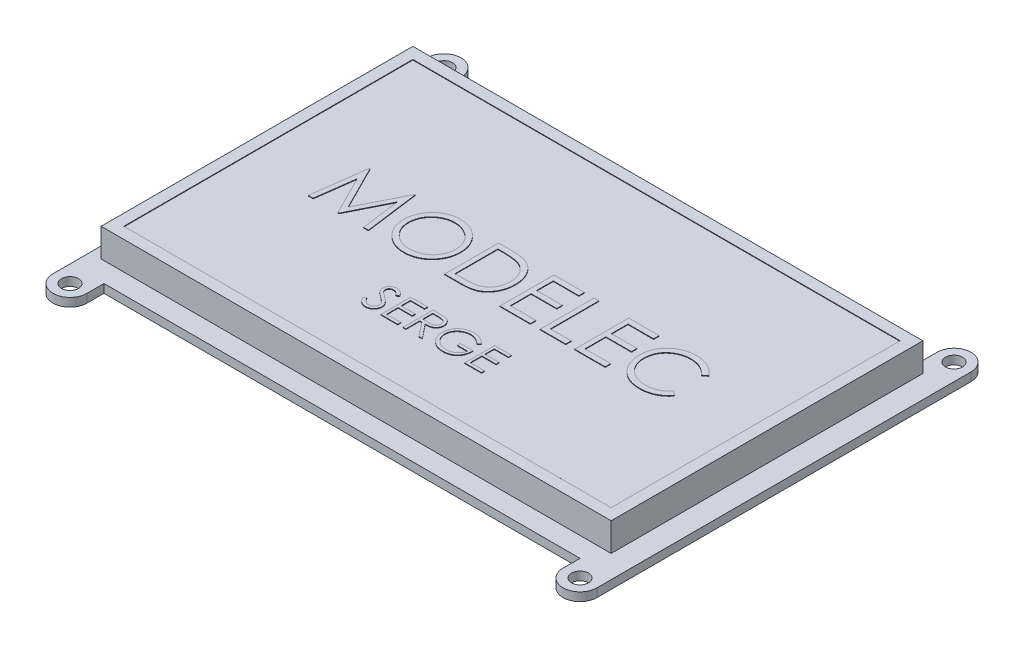
from build123d import *

# Parameters (mm, degrees)
ESQUISSE2_R             = 1.5
BOSS_EXTRU_1_DEPTH      = 1.5
ESQUISSE3_W             = 85
ESQUISSE3_H             = 50
BOSS_EXTRU_2_DEPTH      = 1
ESQUISSE4_W             = 90
ESQUISSE4_H             = 55
BOSS_EXTRU_3_DEPTH      = 5
ESQUISSE5_W             = 86
ESQUISSE5_H             = 51
ENL_V_MAT_EXTRU_1_DEPTH = 0.1
BOSS_EXTRU_4_DEPTH      = 0.1


with BuildPart() as part:
    # Esquisse2 → Boss.-Extru.1 (new body)
    with BuildSketch(Plane(origin=(0, 0, 0), x_dir=(1, 0, 0), z_dir=(0, 1, 0))):
        with BuildLine():
            ThreePointArc((-42, 33), (-45, 36), (-48, 33))
            Line((-48, 33), (-48, 30))
            Line((-48, 30), (-48, -30))
            Line((-48, -30), (-48, -33))
            ThreePointArc((-48, -33), (-45, -36), (-42, -33))
            Line((-42, -33), (-42, -30))
            Line((-42, -30), (42, -30))
            Line((42, -30), (42, -33))
            ThreePointArc((42, -33), (45, -36), (48, -33))
            Line((48, -33), (48, -30))
            Line((48, -30), (48, 30))
            Line((48, 30), (48, 33))
            ThreePointArc((48, 33), (45, 36), (42, 33))
            Line((42, 33), (42, 30))
            Line((42, 30), (-42, 30))
            Line((-42, 30), (-42, 33))
        make_face()
        with Locations(Location((-45, -33, 0), (0, 0, 270))):
            Circle(ESQUISSE2_R, mode=Mode.SUBTRACT)
        with Locations(Location((45, -33, 0), (0, 0, 270))):
            Circle(ESQUISSE2_R, mode=Mode.SUBTRACT)
        with Locations(Location((-45, 33, 0), (0, 0, 270))):
            Circle(ESQUISSE2_R, mode=Mode.SUBTRACT)
        with Locations(Location((45, 33, 0), (0, 0, 270))):
            Circle(ESQUISSE2_R, mode=Mode.SUBTRACT)
    extrude(amount=BOSS_EXTRU_1_DEPTH)


with BuildPart() as body_2:
    # Esquisse3 → Boss.-Extru.2 (new body)
    with BuildSketch(Plane(origin=(0, 1.5, 0), x_dir=(1, 0, 0), z_dir=(0, 1, 0))):
        Rectangle(ESQUISSE3_W, ESQUISSE3_H)
    extrude(amount=BOSS_EXTRU_2_DEPTH)

    # Esquisse4 → Boss.-Extru.3 (add)
    with BuildSketch(Plane(origin=(0, 2.5, 0), x_dir=(1, 0, 0), z_dir=(0, 1, 0))):
        Rectangle(ESQUISSE4_W, ESQUISSE4_H)
    extrude(amount=BOSS_EXTRU_3_DEPTH)

    # Esquisse5 → Enlèv. mat.-Extru.1 (cut)
    with BuildSketch(Plane(origin=(0, 7.5, 0), x_dir=(1, 0, 0), z_dir=(0, 1, 0))):
        Rectangle(ESQUISSE5_W, ESQUISSE5_H)
    extrude(amount=-ENL_V_MAT_EXTRU_1_DEPTH, mode=Mode.SUBTRACT)

    # Esquisse6 → Boss.-Extru.4 (add)
    # profile 1 of 12: a face of its own
    with BuildSketch(Plane(origin=(0, 7.4, 0), x_dir=(1, 0, 0), z_dir=(0, 1, 0))):
        Polygon((-31.444711538, -4.5), (-30.187304687, 5.025), (-30.065189303, 5.025), (-26.132692308, -2.790384615), (-22.209735577, 5.025), (-22.085712139, 5.025), (-20.820673077, -4.5), (-21.679296875, -4.5), (-22.591346154, 2.353725962), (-26.029657452, -4.5), (-26.222370793, -4.5), (-29.674038462, 2.368990385), (-30.584179687, -4.5), align=None)
    # profile 2 of 12: a face of its own
    with BuildSketch(Plane(origin=(0, 7.4, 0), x_dir=(1, 0, 0), z_dir=(0, 1, 0))):
        with BuildLine():
            add(Edge.make_bspline(
                [(-14.409615385, 5.269230769), (-14.233244754, 5.2647636), (-13.886838283, 5.255989712), (-13.377727311, 5.188827295), (-12.891693516, 5.072634841), (-12.424777638, 4.917886295), (-11.982564609, 4.711454004), (-11.561725909, 4.461939421), (-11.163262845, 4.166728487), (-10.792546085, 3.828103234), (-10.453301099, 3.459666835), (-10.154417795, 3.066480522), (-9.903931267, 2.650921639), (-9.698229946, 2.21423895), (-9.536853015, 1.757420037), (-9.425494761, 1.278029501), (-9.354361652, 0.779173437), (-9.346045572, 0.438921755), (-9.341826923, 0.266316106)],
                knots=[0, 0, 0, 0, 1.065120563, 2.091984664, 3.0946048, 4.079830382, 5.057816894, 6.036188127, 7.030412546, 8.04752943, 9.064399622, 10.05169764, 11.02544977, 11.989514704, 12.962713494, 13.945757189, 14.957906945, 16, 16, 16, 16], degree=3))
            add(Edge.make_bspline(
                [(-9.341826923, 0.266316106), (-9.346044954, 0.094981912), (-9.354359181, -0.242737632), (-9.42557564, -0.738428005), (-9.53726579, -1.214924829), (-9.696731343, -1.671432641), (-9.901452109, -2.108433011), (-10.153606539, -2.524776078), (-10.450626548, -2.920598335), (-10.788646621, -3.291563516), (-11.157130886, -3.631735204), (-11.552364683, -3.928150145), (-11.965459361, -4.183213655), (-12.401730781, -4.386732082), (-12.855393024, -4.549397094), (-13.330506346, -4.660302466), (-13.824844468, -4.731840777), (-14.161950557, -4.740055452), (-14.333293269, -4.744230769)],
                knots=[0, 0, 0, 0, 1.043624062, 2.057103931, 3.04512605, 4.022047818, 4.998200453, 5.980619268, 6.982898556, 8.009068085, 9.034988726, 10.034168286, 11.015286542, 11.987931943, 12.962482838, 13.94673481, 14.956375938, 16, 16, 16, 16], degree=3))
            add(Edge.make_bspline(
                [(-14.333293269, -4.744230769), (-14.505898023, -4.740014224), (-14.846147939, -4.73170229), (-15.345630871, -4.660451467), (-15.82535816, -4.549032633), (-16.28395793, -4.389803381), (-16.721685917, -4.184016489), (-17.139398213, -3.933088857), (-17.535418178, -3.635345138), (-17.906462503, -3.297434674), (-18.245958535, -2.92957495), (-18.541939407, -2.53541887), (-18.792923466, -2.122699378), (-18.998019392, -1.690271116), (-19.160391956, -1.240224546), (-19.271167212, -0.769557618), (-19.342838624, -0.280953678), (-19.351097742, 0.051721639), (-19.355288462, 0.220522837)],
                knots=[0, 0, 0, 0, 1.053102029, 2.075944431, 3.073151272, 4.055350789, 5.033113405, 6.020478099, 7.024410459, 8.052272461, 9.079885166, 10.07527673, 11.055994387, 12.023226415, 12.992069828, 13.970394897, 14.97016774, 16, 16, 16, 16], degree=3))
            add(Edge.make_bspline(
                [(-19.355288462, 0.220522837), (-19.353833489, 0.333823172), (-19.3509419, 0.558994508), (-19.316130222, 0.893367184), (-19.265615878, 1.222362474), (-19.193220673, 1.54504484), (-19.098537637, 1.860624377), (-18.986817477, 2.171277524), (-18.850365469, 2.473856087), (-18.696113134, 2.76979346), (-18.523950642, 3.054476403), (-18.333788781, 3.323570126), (-18.132306814, 3.579332696), (-17.911426436, 3.815136328), (-17.678427395, 4.037840778), (-17.429529952, 4.244023601), (-17.166252844, 4.435544003), (-16.887463225, 4.608137932), (-16.600030634, 4.764236719), (-16.30373026, 4.898190471), (-16.002586305, 5.01316011), (-15.695188299, 5.10634407), (-15.38235254, 5.179909825), (-15.063396255, 5.230004123), (-14.738573545, 5.264904588), (-14.519739884, 5.267782504), (-14.409615385, 5.269230769)],
                knots=[0, 0, 0, 0, 1.037015668, 2.060948919, 3.074880161, 4.083647147, 5.086022904, 6.090072063, 7.104153813, 8.122640571, 9.144368836, 10.147691507, 11.138137339, 12.123020368, 13.103399296, 14.087645067, 15.080126199, 16.082011238, 17.087798457, 18.072939717, 19.057185487, 20.037253025, 21.01195951, 21.997135196, 22.992090687, 24, 24, 24, 24], degree=3))
        make_face()
        with BuildLine():
            add(Edge.make_bspline(
                [(-14.367638221, 4.292307692), (-14.458029474, 4.291205812), (-14.637947833, 4.289012587), (-14.905422178, 4.260122675), (-15.169378798, 4.218947763), (-15.429872205, 4.160215196), (-15.685812464, 4.080194166), (-15.939585246, 3.988098552), (-16.188876414, 3.875918298), (-16.432862984, 3.74917401), (-16.669396153, 3.608887304), (-16.892587862, 3.453842709), (-17.103015914, 3.287676215), (-17.30016509, 3.110000029), (-17.483456494, 2.919909327), (-17.656497718, 2.720285912), (-17.812352793, 2.50542398), (-17.955188542, 2.281149944), (-18.083008164, 2.047755927), (-18.196669594, 1.807699087), (-18.289644504, 1.55902124), (-18.36546997, 1.304420282), (-18.428334456, 1.044299445), (-18.468159635, 0.776685457), (-18.497366984, 0.502923045), (-18.49943485, 0.317915285), (-18.500480769, 0.224338942)],
                knots=[0, 0, 0, 0, 1.008559885, 2.007477868, 2.99961109, 3.989939068, 4.984837346, 5.991145699, 7.001802488, 8.033829008, 9.059044045, 10.069351652, 11.065060232, 12.050310815, 13.029377138, 14.011219647, 14.996725999, 15.989392538, 16.977580475, 17.965360261, 18.951710183, 19.937753436, 20.929683414, 21.935841486, 22.955955122, 24, 24, 24, 24], degree=3))
            add(Edge.make_bspline(
                [(-18.500480769, 0.224338942), (-18.497011323, 0.08673747), (-18.49018585, -0.183967195), (-18.430429892, -0.580664786), (-18.338385804, -0.961905051), (-18.202702543, -1.325601961), (-18.033019798, -1.67488176), (-17.823396618, -2.006645959), (-17.575041536, -2.320984224), (-17.292928652, -2.615702063), (-16.984529001, -2.884703859), (-16.657052072, -3.120824278), (-16.314006183, -3.32060503), (-15.954496752, -3.483360262), (-15.580443093, -3.612328049), (-15.1894349, -3.700716323), (-14.784076864, -3.758888098), (-14.507768438, -3.764474527), (-14.367638221, -3.767307692)],
                knots=[0, 0, 0, 0, 1.032063989, 2.030389145, 3.003944642, 3.970395727, 4.937377036, 5.913328081, 6.909231446, 7.93887556, 8.970685674, 9.976071282, 10.964166581, 11.944589148, 12.933237628, 13.927779006, 14.949070134, 16, 16, 16, 16], degree=3))
            add(Edge.make_bspline(
                [(-14.367638221, -3.767307692), (-14.273450935, -3.766013641), (-14.086649257, -3.763447149), (-13.808803586, -3.737597178), (-13.535963466, -3.696144734), (-13.26851159, -3.636462021), (-13.006751497, -3.561766409), (-12.74959064, -3.473026807), (-12.49976815, -3.362315817), (-12.254132448, -3.239993177), (-12.019011247, -3.100546748), (-11.794559977, -2.950764355), (-11.586436061, -2.784842609), (-11.389434374, -2.609806276), (-11.205390449, -2.42212609), (-11.035548856, -2.222046058), (-10.880481496, -2.008303269), (-10.737699986, -1.784369415), (-10.61032825, -1.550336756), (-10.499350845, -1.309409561), (-10.405199987, -1.062181085), (-10.329194556, -0.808294737), (-10.269634835, -0.548232713), (-10.22859591, -0.2816468), (-10.199889088, -0.009070304), (-10.197725342, 0.175289762), (-10.196634615, 0.268224159)],
                knots=[0, 0, 0, 0, 1.047197238, 2.076906641, 3.100256066, 4.114471768, 5.12198147, 6.126382909, 7.136867548, 8.15857795, 9.17633901, 10.174870724, 11.156907918, 12.133735059, 13.104061851, 14.077631395, 15.04955518, 16.038496417, 17.029181396, 18.010275684, 18.986308667, 19.968651475, 20.955262928, 21.950658345, 22.966943676, 24, 24, 24, 24], degree=3))
            add(Edge.make_bspline(
                [(-10.196634615, 0.268224159), (-10.197726216, 0.360522781), (-10.199891606, 0.5436141), (-10.228582198, 0.814289613), (-10.269678192, 1.078957282), (-10.328903848, 1.33657806), (-10.405240337, 1.587217617), (-10.499367287, 1.830640552), (-10.610361566, 2.067753712), (-10.737746805, 2.297971048), (-10.88093701, 2.5188823), (-11.037403487, 2.730071722), (-11.209847756, 2.927573254), (-11.393342866, 3.116262671), (-11.592472204, 3.292115642), (-11.806333747, 3.455190502), (-12.032331185, 3.60942277), (-12.271618875, 3.748557335), (-12.518572064, 3.877047497), (-12.771975049, 3.987132012), (-13.028957099, 4.08067328), (-13.288864719, 4.160457306), (-13.553885539, 4.218717731), (-13.822228816, 4.260159781), (-14.093523291, 4.289002531), (-14.275976625, 4.291202476), (-14.367638221, 4.292307692)],
                knots=[0, 0, 0, 0, 1.02996197, 2.043119294, 3.035359645, 4.018872909, 4.991431989, 5.957985074, 6.929999688, 7.912076566, 8.892894881, 9.867085534, 10.843653904, 11.817741046, 12.803660682, 13.806313499, 14.818574707, 15.856120519, 16.894564902, 17.924820532, 18.937903209, 19.946497019, 20.957711757, 21.963978472, 22.977135795, 24, 24, 24, 24], degree=3))
        make_face(mode=Mode.SUBTRACT)
    # profile 3 of 12: a face of its own
    with BuildSketch(Plane(origin=(0, 7.4, 0), x_dir=(1, 0, 0), z_dir=(0, 1, 0))):
        with BuildLine():
            Line((-7.387980769, -4.5), (-7.387980769, 5.025))
            Line((-7.387980769, 5.025), (-5.464663462, 5.025))
            add(Edge.make_bspline(
                [(-5.464663462, 5.025), (-5.297380001, 5.023795577), (-4.974189225, 5.021468639), (-4.507158207, 5.00671471), (-4.07503954, 4.980614943), (-3.679254402, 4.942597875), (-3.318716246, 4.895917119), (-2.994434606, 4.837405305), (-2.704732702, 4.768313212), (-2.526562296, 4.709406666), (-2.442307692, 4.681550481)],
                knots=[0, 0, 0, 0, 1.314313732, 2.53924729, 3.670748893, 4.714932338, 5.66265055, 6.526160246, 7.303039223, 8, 8, 8, 8], degree=3))
            add(Edge.make_bspline(
                [(-2.442307692, 4.681550481), (-2.332104152, 4.639556918), (-2.114196121, 4.556522066), (-1.803933881, 4.399886703), (-1.511855571, 4.222413905), (-1.236394899, 4.023869735), (-0.983844078, 3.798632473), (-0.744336873, 3.556269975), (-0.527671089, 3.28796885), (-0.329256369, 2.999293347), (-0.150361468, 2.693644119), (0.005138669, 2.371603573), (0.134281322, 2.034807171), (0.241487175, 1.684191518), (0.325977891, 1.318985661), (0.383623005, 0.938764355), (0.421644056, 0.545030275), (0.425465082, 0.277855484), (0.427403846, 0.142292668)],
                knots=[0, 0, 0, 0, 0.984719456, 1.947108742, 2.898477687, 3.838006223, 4.779231079, 5.722358779, 6.681677486, 7.655904652, 8.64651281, 9.637519902, 10.640069247, 11.656948941, 12.698408672, 13.768548281, 14.867775369, 16, 16, 16, 16], degree=3))
            add(Edge.make_bspline(
                [(0.427403846, 0.142292668), (0.425692156, 0.024560298), (0.422319092, -0.207443635), (0.392031454, -0.549366358), (0.348008754, -0.881145434), (0.279852759, -1.201200947), (0.19711449, -1.512337025), (0.091076335, -1.811237633), (-0.030395979, -2.100644714), (-0.172046006, -2.376645131), (-0.327552204, -2.638129165), (-0.494434948, -2.884623996), (-0.67251624, -3.112612278), (-0.863494212, -3.322784429), (-1.064900926, -3.51482361), (-1.278054998, -3.690334024), (-1.503506443, -3.845881505), (-1.740245481, -3.987578421), (-1.995178376, -4.111186674), (-2.27313384, -4.215771201), (-2.57529726, -4.30243949), (-2.900926957, -4.374750285), (-3.250585565, -4.432110658), (-3.624615893, -4.470554626), (-4.022443274, -4.49655225), (-4.295618275, -4.498828435), (-4.436222957, -4.5)],
                knots=[0, 0, 0, 0, 1.105936401, 2.179363191, 3.223086493, 4.248585256, 5.251745608, 6.245858792, 7.225916811, 8.198733463, 9.158002045, 10.082870192, 10.993790845, 11.873723703, 12.748670949, 13.606408763, 14.465103618, 15.319838547, 16.196477973, 17.123216899, 18.106603292, 19.147568657, 20.255746949, 21.433717677, 22.679120308, 24, 24, 24, 24], degree=3))
            Line((-4.436222957, -4.5), (-7.387980769, -4.5))
        make_face()
        with BuildLine():
            Line((-6.533173077, -3.523076923), (-5.439858774, -3.523076923))
            add(Edge.make_bspline(
                [(-5.439858774, -3.523076923), (-5.282755137, -3.522401747), (-4.980587307, -3.521103135), (-4.546089471, -3.50970796), (-4.149089114, -3.491088116), (-3.789529863, -3.465030226), (-3.467614733, -3.430553495), (-3.182670956, -3.392113581), (-2.935632575, -3.344223375), (-2.786146035, -3.300813979), (-2.717067308, -3.280754207)],
                knots=[0, 0, 0, 0, 1.375205317, 2.645023457, 3.804390687, 4.853969522, 5.800190428, 6.637939096, 7.370582563, 8, 8, 8, 8], degree=3))
            add(Edge.make_bspline(
                [(-2.717067308, -3.280754207), (-2.630122122, -3.250133895), (-2.458308436, -3.189624636), (-2.210982054, -3.079249858), (-1.98032192, -2.948506797), (-1.762308208, -2.803176323), (-1.560033524, -2.63813256), (-1.371100751, -2.456964369), (-1.195890277, -2.258749731), (-1.036212339, -2.043734663), (-0.89331474, -1.813257433), (-0.769568037, -1.569583893), (-0.66111494, -1.315383931), (-0.575992485, -1.046754006), (-0.509275073, -0.76609564), (-0.462018315, -0.473389089), (-0.432586815, -0.168689014), (-0.429153875, 0.038553552), (-0.427403846, 0.144200721)],
                knots=[0, 0, 0, 0, 0.998632004, 1.973411704, 2.929992603, 3.868527914, 4.809262121, 5.754881198, 6.702106254, 7.672490631, 8.653608572, 9.636854334, 10.631411391, 11.644891563, 12.686317036, 13.754757253, 14.855430412, 16, 16, 16, 16], degree=3))
            add(Edge.make_bspline(
                [(-0.427403846, 0.144200721), (-0.428800721, 0.255598264), (-0.431544894, 0.474439723), (-0.466037125, 0.795542972), (-0.516442215, 1.104372457), (-0.589332103, 1.400948831), (-0.682216852, 1.685850704), (-0.798135127, 1.957502371), (-0.930577855, 2.218772764), (-1.088157651, 2.463631574), (-1.260738658, 2.695206392), (-1.45226703, 2.907355127), (-1.659699863, 3.100561044), (-1.880774704, 3.277833031), (-2.121722095, 3.432039177), (-2.376866068, 3.569979359), (-2.649949645, 3.687044035), (-2.83993991, 3.749307226), (-2.936493389, 3.780949519)],
                knots=[0, 0, 0, 0, 1.122418816, 2.205001699, 3.251619955, 4.274784885, 5.280384055, 6.268708349, 7.249350384, 8.229342522, 9.199999885, 10.157847722, 11.105861043, 12.055065948, 13.010012805, 13.98527497, 14.976112212, 16, 16, 16, 16], degree=3))
            add(Edge.make_bspline(
                [(-2.936493389, 3.780949519), (-3.016370438, 3.803037798), (-3.186210958, 3.850003539), (-3.463359786, 3.901235445), (-3.775276728, 3.946423404), (-4.123346629, 3.984681353), (-4.507172721, 4.012133278), (-4.927050201, 4.03273807), (-5.383160553, 4.046635405), (-5.69934302, 4.047584387), (-5.863446514, 4.048076923)],
                knots=[0, 0, 0, 0, 0.674548936, 1.434276114, 2.292660221, 3.240891867, 4.284742987, 5.42552168, 6.663806718, 8, 8, 8, 8], degree=3))
            Line((-5.863446514, 4.048076923), (-6.533173077, 4.048076923))
            Line((-6.533173077, 4.048076923), (-6.533173077, -3.523076923))
        make_face(mode=Mode.SUBTRACT)
    # profile 4 of 12: a face of its own
    with BuildSketch(Plane(origin=(0, 7.4, 0), x_dir=(1, 0, 0), z_dir=(0, 1, 0))):
        Polygon((2.38125, 5.025), (7.754326923, 5.025), (7.754326923, 4.048076923), (3.236057692, 4.048076923), (3.236057692, 1.117307692), (7.754326923, 1.117307692), (7.754326923, 0.140384615), (3.236057692, 0.140384615), (3.236057692, -3.523076923), (7.754326923, -3.523076923), (7.754326923, -4.5), (2.38125, -4.5), align=None)
    # profile 5 of 12: a face of its own
    with BuildSketch(Plane(origin=(0, 7.4, 0), x_dir=(1, 0, 0), z_dir=(0, 1, 0))):
        Polygon((9.463942308, 5.025), (10.31875, 5.025), (10.31875, -3.523076923), (13.982211538, -3.523076923), (13.982211538, -4.5), (9.463942308, -4.5), align=None)
    # profile 6 of 12: a face of its own
    with BuildSketch(Plane(origin=(0, 7.4, 0), x_dir=(1, 0, 0), z_dir=(0, 1, 0))):
        Polygon((15.569711538, 5.025), (20.942788462, 5.025), (20.942788462, 4.048076923), (16.424519231, 4.048076923), (16.424519231, 1.117307692), (20.942788462, 1.117307692), (20.942788462, 0.140384615), (16.424519231, 0.140384615), (16.424519231, -3.523076923), (20.942788462, -3.523076923), (20.942788462, -4.5), (15.569711538, -4.5), align=None)
    # profile 7 of 12: a face of its own
    with BuildSketch(Plane(origin=(0, 7.4, 0), x_dir=(1, 0, 0), z_dir=(0, 1, 0))):
        with BuildLine():
            Line((31.444711538, 3.277223558), (30.696754808, 2.704807692))
            add(Edge.make_bspline(
                [(30.696754808, 2.704807692), (30.643398783, 2.76839651), (30.537406088, 2.894716831), (30.366883544, 3.072098305), (30.189169788, 3.238283053), (30.004332751, 3.394062739), (29.809045433, 3.533989795), (29.608038545, 3.665356153), (29.397949579, 3.783106212), (29.107432358, 3.925880481), (28.727390714, 4.074868231), (28.248977616, 4.199790597), (27.74956527, 4.279313939), (27.408848945, 4.287926829), (27.235546875, 4.292307692)],
                knots=[0, 0, 0, 0, 0.757959112, 1.505699292, 2.245454638, 2.979532153, 3.711538275, 4.438200793, 5.171680507, 5.909471876, 7.393775596, 8.890124382, 10.418191784, 12, 12, 12, 12], degree=3))
            add(Edge.make_bspline(
                [(27.235546875, 4.292307692), (27.140070182, 4.291208337), (26.950002909, 4.28901983), (26.667930992, 4.260147854), (26.391126189, 4.219568061), (26.119768555, 4.159355574), (25.854203504, 4.083230089), (25.592694896, 3.992265213), (25.339028906, 3.87972097), (25.089696415, 3.755329205), (24.850811562, 3.614828802), (24.624783182, 3.461576037), (24.412435641, 3.297285853), (24.213600961, 3.121342485), (24.028075873, 2.934538293), (23.857204691, 2.734882477), (23.701578682, 2.523013348), (23.558113064, 2.301724718), (23.429626982, 2.071661156), (23.322049239, 1.831971143), (23.226785299, 1.586759263), (23.151403789, 1.333255032), (23.091737782, 1.073242219), (23.050568927, 0.806023003), (23.022025302, 0.532155633), (23.019847678, 0.34652886), (23.01875, 0.252959736)],
                knots=[0, 0, 0, 0, 1.054917814, 2.100044995, 3.131103042, 4.146048494, 5.169673617, 6.183595914, 7.203665975, 8.234915748, 9.262203917, 10.264457458, 11.251630812, 12.227803204, 13.197192746, 14.159520551, 15.12972552, 16.100847026, 17.073214652, 18.039054194, 19.002613845, 19.979014051, 20.95965708, 21.949030935, 22.966165397, 24, 24, 24, 24], degree=3))
            add(Edge.make_bspline(
                [(23.01875, 0.252959736), (23.02218395, 0.112176644), (23.028926056, -0.164232284), (23.088929023, -0.569100874), (23.180110735, -0.956960708), (23.316768841, -1.325387278), (23.485277115, -1.678923596), (23.69820335, -2.011587904), (23.944809784, -2.328407269), (24.228585168, -2.621894148), (24.539932425, -2.889992215), (24.873982098, -3.126077726), (25.229902196, -3.322877513), (25.603762882, -3.486642053), (25.998441092, -3.612526434), (26.41322709, -3.70114737), (26.847218735, -3.758956447), (27.143771173, -3.764490984), (27.294696514, -3.767307692)],
                knots=[0, 0, 0, 0, 1.029171465, 2.020641659, 2.987623507, 3.938342917, 4.889210282, 5.84687017, 6.821220943, 7.821438502, 8.827599549, 9.822697543, 10.807740252, 11.797342354, 12.80366471, 13.83203677, 14.896651826, 16, 16, 16, 16], degree=3))
            add(Edge.make_bspline(
                [(27.294696514, -3.767307692), (27.460983118, -3.762711799), (27.788274933, -3.753665981), (28.268247919, -3.677032596), (28.727722395, -3.552777834), (29.166723077, -3.378884202), (29.584012365, -3.152827955), (29.980243276, -2.878785874), (30.355750264, -2.554151197), (30.581550682, -2.306274969), (30.696754808, -2.179807692)],
                knots=[0, 0, 0, 0, 1.028121516, 2.023589091, 2.998037872, 3.967518031, 4.937445131, 5.927275754, 6.942489185, 8, 8, 8, 8], degree=3))
            Line((30.696754808, -2.179807692), (31.444711538, -2.746499399))
            add(Edge.make_bspline(
                [(31.444711538, -2.746499399), (31.384518682, -2.824164757), (31.26442129, -2.979123462), (31.069953401, -3.197577186), (30.865091613, -3.403056025), (30.648314288, -3.593903338), (30.422115155, -3.77393799), (30.182432648, -3.938045117), (29.932417638, -4.088515309), (29.672917235, -4.226292868), (29.404207153, -4.348531947), (29.126609369, -4.45318113), (28.841320446, -4.543328151), (28.548327341, -4.61749235), (28.247022317, -4.675380085), (27.93849267, -4.714077915), (27.622072509, -4.740589839), (27.408599785, -4.743006238), (27.300420673, -4.744230769)],
                knots=[0, 0, 0, 0, 0.986787822, 1.968848986, 2.935600012, 3.899624008, 4.868462664, 5.837806735, 6.815139263, 7.798259679, 8.787526145, 9.778297419, 10.776456485, 11.791383307, 12.812564526, 13.85620153, 14.913611965, 16, 16, 16, 16], degree=3))
            add(Edge.make_bspline(
                [(27.300420673, -4.744230769), (27.197976122, -4.743517775), (26.995404708, -4.742107918), (26.696323106, -4.719269234), (26.405158604, -4.688109592), (26.122743372, -4.641191807), (25.847536254, -4.585826139), (25.582032092, -4.511609362), (25.323618269, -4.428471987), (25.073332999, -4.33075913), (24.830963388, -4.220497234), (24.597291158, -4.095878777), (24.372423782, -3.957951702), (24.154150458, -3.809756281), (23.945695605, -3.646532338), (23.745252797, -3.470546711), (23.551698058, -3.282392554), (23.431947894, -3.146716131), (23.371739784, -3.078500601)],
                knots=[0, 0, 0, 0, 1.114604814, 2.203992996, 3.262667896, 4.300477797, 5.318619304, 6.316056647, 7.298880507, 8.271930387, 9.238335007, 10.195173496, 11.151986948, 12.108099108, 13.064862484, 14.031167946, 15.010108607, 16, 16, 16, 16], degree=3))
            add(Edge.make_bspline(
                [(23.371739784, -3.078500601), (23.275304211, -2.960006365), (23.08359732, -2.724448461), (22.83832671, -2.342670183), (22.628375149, -1.944067415), (22.458623536, -1.526546037), (22.325919241, -1.091042933), (22.233986132, -0.637338569), (22.174246408, -0.165856669), (22.167414836, 0.154827734), (22.163942308, 0.317833534)],
                knots=[0, 0, 0, 0, 0.994628077, 1.977248131, 2.950237994, 3.925870899, 4.908910175, 5.911660606, 6.938484602, 8, 8, 8, 8], degree=3))
            add(Edge.make_bspline(
                [(22.163942308, 0.317833534), (22.168174656, 0.489162304), (22.176501537, 0.826240963), (22.247247237, 1.320925793), (22.361054104, 1.794866385), (22.522698494, 2.247178004), (22.727636628, 2.680239696), (22.980801913, 3.09074326), (23.279253207, 3.481313979), (23.620649802, 3.846025553), (23.995029479, 4.179507648), (24.395947108, 4.472894531), (24.822617978, 4.717054342), (25.27034156, 4.921151041), (25.742470451, 5.07802633), (26.237997334, 5.187844646), (26.755991095, 5.256199084), (27.10940241, 5.264840185), (27.288972356, 5.269230769)],
                knots=[0, 0, 0, 0, 1.032925535, 2.032216505, 3.007276963, 3.968222605, 4.92396291, 5.891752235, 6.871517503, 7.883894988, 8.900124299, 9.891468569, 10.874487609, 11.85992873, 12.854644235, 13.869047385, 14.917252991, 16, 16, 16, 16], degree=3))
            add(Edge.make_bspline(
                [(27.288972356, 5.269230769), (27.398413169, 5.267918665), (27.615040236, 5.265321486), (27.935495669, 5.239995485), (28.247486573, 5.197776313), (28.551227888, 5.140310438), (28.848197294, 5.068989084), (29.136125092, 4.976078701), (29.416700804, 4.869843569), (29.68815489, 4.747492316), (29.94918493, 4.610150684), (30.199709626, 4.459341022), (30.437738991, 4.295250294), (30.664947929, 4.119274081), (30.877535617, 3.927689431), (31.081537927, 3.725765973), (31.270027004, 3.507687495), (31.38637677, 3.354185496), (31.444711538, 3.277223558)],
                knots=[0, 0, 0, 0, 1.096760587, 2.17092713, 3.219439832, 4.250915756, 5.268269357, 6.278326846, 7.281116186, 8.274029601, 9.260640565, 10.235837813, 11.203064059, 12.156899882, 13.114053108, 14.069676657, 15.032185724, 16, 16, 16, 16], degree=3))
        make_face()
    # profile 8 of 12: a face of its own
    with BuildSketch(Plane(origin=(0, 7.4, 0), x_dir=(1, 0, 0), z_dir=(0, 1, 0))):
        with BuildLine():
            Line((-11.058226496, -15.277400484), (-10.610894097, -15.009213051))
            add(Edge.make_bspline(
                [(-10.610894097, -15.009213051), (-10.569289143, -15.078858014), (-10.489575657, -15.212295075), (-10.356601578, -15.392601874), (-10.218817296, -15.545851802), (-10.07520247, -15.671153339), (-9.926633715, -15.769803442), (-9.772141158, -15.839656816), (-9.61224542, -15.883223826), (-9.503427857, -15.888515624), (-9.449101896, -15.891157495)],
                knots=[0, 0, 0, 0, 1.272034388, 2.437168799, 3.508375237, 4.49857839, 5.41946034, 6.295179144, 7.148887113, 8, 8, 8, 8], degree=3))
            add(Edge.make_bspline(
                [(-9.449101896, -15.891157495), (-9.402706286, -15.889865312), (-9.310726879, -15.887303555), (-9.175317297, -15.862688533), (-9.043809096, -15.824872576), (-8.918912704, -15.770714739), (-8.802351477, -15.705191076), (-8.700136592, -15.626048641), (-8.611771635, -15.53744164), (-8.539488807, -15.438589293), (-8.484032087, -15.332276461), (-8.441408365, -15.223153296), (-8.417754504, -15.10950558), (-8.414191317, -15.03298738), (-8.412393162, -14.994372639)],
                knots=[0, 0, 0, 0, 1.095163259, 2.171163733, 3.241058638, 4.321873601, 5.38011039, 6.391990106, 7.366004449, 8.327778327, 9.272591725, 10.192022065, 11.087607919, 12, 12, 12, 12], degree=3))
            add(Edge.make_bspline(
                [(-8.412393162, -14.994372639), (-8.41462218, -14.95031445), (-8.419153446, -14.860750589), (-8.457452232, -14.728610638), (-8.517700498, -14.597842109), (-8.573282114, -14.516953291), (-8.602138421, -14.474958243)],
                knots=[0, 0, 0, 0, 0.938893495, 1.908633276, 2.914225137, 4, 4, 4, 4], degree=3))
            add(Edge.make_bspline(
                [(-8.602138421, -14.474958243), (-8.625830898, -14.444649355), (-8.675570288, -14.381019636), (-8.76107986, -14.286306006), (-8.861419105, -14.188609111), (-8.973154241, -14.084198394), (-9.100355459, -13.977929939), (-9.239038725, -13.864736233), (-9.392744797, -13.748921944), (-9.500542846, -13.671251517), (-9.556164864, -13.631174856)],
                knots=[0, 0, 0, 0, 0.722233717, 1.516239348, 2.393582979, 3.351407094, 4.387010283, 5.505090956, 6.712668013, 8, 8, 8, 8], degree=3))
            add(Edge.make_bspline(
                [(-9.556164864, -13.631174856), (-9.611839239, -13.59151973), (-9.718284405, -13.515702148), (-9.867144404, -13.403179718), (-10.000259247, -13.300303868), (-10.117037284, -13.206106135), (-10.217427151, -13.120573745), (-10.302219927, -13.044528051), (-10.369255602, -12.975912429), (-10.406532492, -12.931399924), (-10.423268897, -12.911414907)],
                knots=[0, 0, 0, 0, 1.452282411, 2.77665338, 3.964542531, 5.026858415, 5.96415736, 6.766646006, 7.446254459, 8, 8, 8, 8], degree=3))
            add(Edge.make_bspline(
                [(-10.423268897, -12.911414907), (-10.446661912, -12.880268101), (-10.492667415, -12.819013728), (-10.55339459, -12.723272574), (-10.605009753, -12.62526597), (-10.64547185, -12.524730556), (-10.679544467, -12.423077747), (-10.702461814, -12.31898122), (-10.716811902, -12.212908071), (-10.718281453, -12.141525755), (-10.719017094, -12.105792578)],
                knots=[0, 0, 0, 0, 1.068054152, 2.10047183, 3.106115577, 4.101338837, 5.06977816, 6.043150881, 7.020423561, 8, 8, 8, 8], degree=3))
            add(Edge.make_bspline(
                [(-10.719017094, -12.105792578), (-10.717043742, -12.049807086), (-10.713139218, -11.939032751), (-10.680118436, -11.777212329), (-10.627998704, -11.622716198), (-10.554981433, -11.477073908), (-10.460854245, -11.344077722), (-10.351927593, -11.222197808), (-10.222188798, -11.119738165), (-10.079838999, -11.030215172), (-9.924027579, -10.960144547), (-9.760755618, -10.907286875), (-9.589763616, -10.877337164), (-9.473946972, -10.873039174), (-9.415180956, -10.87085835)],
                knots=[0, 0, 0, 0, 1.005424448, 1.989358655, 2.955360095, 3.929531133, 4.905563448, 5.876582895, 6.856512386, 7.866279853, 8.892233794, 9.918561126, 10.94386622, 12, 12, 12, 12], degree=3))
            add(Edge.make_bspline(
                [(-9.415180956, -10.87085835), (-9.352823805, -10.873009112), (-9.228815332, -10.877286293), (-9.046405209, -10.914475417), (-8.870781268, -10.976010957), (-8.729503951, -11.045843809), (-8.618934181, -11.115590116), (-8.534611121, -11.179120088), (-8.449162118, -11.252258645), (-8.361897916, -11.335200601), (-8.274297157, -11.428706998), (-8.185059319, -11.532137445), (-8.093975722, -11.644859856), (-8.035380552, -11.725330233), (-8.00534188, -11.766583176)],
                knots=[0, 0, 0, 0, 1.286793592, 2.559021753, 3.825965368, 5.121522368, 5.803751409, 6.523245864, 7.299691795, 8.125521123, 9.008227632, 9.944561021, 10.946284179, 12, 12, 12, 12], degree=3))
            Line((-8.00534188, -11.766583176), (-8.434653779, -12.092012196))
            add(Edge.make_bspline(
                [(-8.434653779, -12.092012196), (-8.460576796, -12.0586162), (-8.510498466, -11.994303319), (-8.586289476, -11.904237164), (-8.657724932, -11.821964629), (-8.728104703, -11.750504257), (-8.793711741, -11.685942698), (-8.857388698, -11.630667828), (-8.918219205, -11.584138058), (-8.994898343, -11.534481724), (-9.091233465, -11.485259391), (-9.212162466, -11.443607809), (-9.338536954, -11.418578132), (-9.424609135, -11.415268742), (-9.468182425, -11.413593393)],
                knots=[0, 0, 0, 0, 1.181633172, 2.275549214, 3.290209073, 4.226197932, 5.078386478, 5.862611352, 6.581680152, 7.217281963, 8.414376989, 9.595101626, 10.782541182, 12, 12, 12, 12], degree=3))
            add(Edge.make_bspline(
                [(-9.468182425, -11.413593393), (-9.522847644, -11.415425368), (-9.628264368, -11.418958159), (-9.777928177, -11.457541946), (-9.912629707, -11.518293092), (-10.028369894, -11.603435975), (-10.124734133, -11.704311762), (-10.194441196, -11.820394079), (-10.236396802, -11.948576997), (-10.241516534, -12.037993549), (-10.244123932, -12.083531961)],
                knots=[0, 0, 0, 0, 1.14458467, 2.207223713, 3.21896685, 4.227309161, 5.202851033, 6.127160689, 7.046193047, 8, 8, 8, 8], degree=3))
            add(Edge.make_bspline(
                [(-10.244123932, -12.083531961), (-10.243529562, -12.111882411), (-10.24233985, -12.168629669), (-10.225747001, -12.252466938), (-10.204430158, -12.336092415), (-10.170650227, -12.41913013), (-10.124015065, -12.503032315), (-10.062775097, -12.589243752), (-9.985647828, -12.678524311), (-9.926567107, -12.736592603), (-9.895374265, -12.767250911)],
                knots=[0, 0, 0, 0, 0.858281714, 1.717966888, 2.583508476, 3.4729293, 4.427298488, 5.488583878, 6.674047936, 8, 8, 8, 8], degree=3))
            add(Edge.make_bspline(
                [(-9.895374265, -12.767250911), (-9.883791, -12.777587843), (-9.856271813, -12.802146027), (-9.805961782, -12.842351023), (-9.739524456, -12.891945691), (-9.6586947, -12.953309848), (-9.561982141, -13.024492534), (-9.449376145, -13.104583591), (-9.322131923, -13.196183035), (-9.231838074, -13.260223602), (-9.184094551, -13.294085513)],
                knots=[0, 0, 0, 0, 0.420754252, 0.999615792, 1.744751191, 2.668019286, 3.750313428, 4.999500688, 6.413464383, 8, 8, 8, 8], degree=3))
            add(Edge.make_bspline(
                [(-9.184094551, -13.294085513), (-9.126663468, -13.335876616), (-9.015456135, -13.416799296), (-8.857223842, -13.538380145), (-8.713753441, -13.657288081), (-8.584541217, -13.772763749), (-8.468310653, -13.883931223), (-8.366351242, -13.992127936), (-8.277624082, -14.096578742), (-8.182103121, -14.230492041), (-8.084497846, -14.39495868), (-8.000675567, -14.596462684), (-7.947821875, -14.798749978), (-7.940910179, -14.93471079), (-7.9375, -15.001792845)],
                knots=[0, 0, 0, 0, 1.163667725, 2.253281268, 3.268753668, 4.215851969, 5.092017293, 5.902905408, 6.650798638, 7.335211899, 8.59617414, 9.77448103, 10.901945474, 12, 12, 12, 12], degree=3))
            add(Edge.make_bspline(
                [(-7.9375, -15.001792845), (-7.93849353, -15.049233945), (-7.940461297, -15.14319487), (-7.963080774, -15.281163855), (-7.99622122, -15.415165289), (-8.046170371, -15.543542804), (-8.107135146, -15.668645005), (-8.18449364, -15.787190283), (-8.274161211, -15.901802338), (-8.377021784, -16.009424998), (-8.489576898, -16.108222222), (-8.608539151, -16.196107827), (-8.734103254, -16.269387316), (-8.865588043, -16.329184423), (-9.003023718, -16.375952955), (-9.146364058, -16.409839079), (-9.295845343, -16.430636404), (-9.397446071, -16.432795043), (-9.449101896, -16.433892538)],
                knots=[0, 0, 0, 0, 0.983748083, 1.948392443, 2.894712957, 3.844097841, 4.80183111, 5.778335162, 6.776009319, 7.81870978, 8.863265674, 9.881300176, 10.883814829, 11.87499822, 12.874611388, 13.892143829, 14.928324115, 16, 16, 16, 16], degree=3))
            add(Edge.make_bspline(
                [(-9.449101896, -16.433892538), (-9.489069617, -16.43311968), (-9.568501707, -16.431583698), (-9.685991043, -16.418004857), (-9.80110685, -16.398792927), (-9.912404634, -16.368291654), (-10.021318339, -16.331284796), (-10.127374277, -16.285718507), (-10.230623847, -16.231112739), (-10.331645668, -16.168678594), (-10.430182813, -16.096019861), (-10.525311057, -16.011393265), (-10.620151611, -15.9171328), (-10.711905174, -15.810678734), (-10.802427666, -15.693750918), (-10.889934309, -15.565255367), (-10.97623643, -15.425891987), (-11.030386006, -15.327822155), (-11.058226496, -15.277400484)],
                knots=[0, 0, 0, 0, 0.915332311, 1.819136955, 2.706846663, 3.586547465, 4.459518054, 5.340707479, 6.227863349, 7.133153174, 8.059268498, 9.028702269, 10.047606654, 11.120612155, 12.245963614, 13.433783089, 14.680604001, 16, 16, 16, 16], degree=3))
        make_face()
    # profile 9 of 12: a face of its own
    with BuildSketch(Plane(origin=(0, 7.4, 0), x_dir=(1, 0, 0), z_dir=(0, 1, 0))):
        Polygon((-6.852029915, -11.006542111), (-3.866987179, -11.006542111), (-3.866987179, -11.549277153), (-6.377136752, -11.549277153), (-6.377136752, -13.177482282), (-3.866987179, -13.177482282), (-3.866987179, -13.720217324), (-6.377136752, -13.720217324), (-6.377136752, -15.755473735), (-3.866987179, -15.755473735), (-3.866987179, -16.298208777), (-6.852029915, -16.298208777), align=None)
    # profile 10 of 12: a face of its own
    with BuildSketch(Plane(origin=(0, 7.4, 0), x_dir=(1, 0, 0), z_dir=(0, 1, 0))):
        with BuildLine():
            Line((-2.917200855, -11.006542111), (-1.858231504, -11.006542111))
            add(Edge.make_bspline(
                [(-1.858231504, -11.006542111), (-1.787563369, -11.006777342), (-1.651872722, -11.007229012), (-1.457482182, -11.009747487), (-1.280850738, -11.016965858), (-1.122070743, -11.023177645), (-0.98114511, -11.034504746), (-0.857641706, -11.045330963), (-0.752129354, -11.059503045), (-0.68825765, -11.072664816), (-0.659338275, -11.078624108)],
                knots=[0, 0, 0, 0, 1.410062039, 2.707475311, 3.878576406, 4.937260626, 5.877586885, 6.699081471, 7.410979367, 8, 8, 8, 8], degree=3))
            add(Edge.make_bspline(
                [(-0.659338275, -11.078624108), (-0.620623498, -11.088189575), (-0.544019835, -11.107116451), (-0.433726283, -11.147120848), (-0.328627245, -11.193414804), (-0.229159297, -11.247788524), (-0.13582066, -11.310645631), (-0.047648928, -11.380901007), (0.035755999, -11.458170235), (0.111021082, -11.544401483), (0.181988458, -11.634868587), (0.241842691, -11.732694505), (0.293438678, -11.834992291), (0.334517912, -11.942802315), (0.367595325, -12.055079042), (0.390918329, -12.172839484), (0.404905244, -12.295547149), (0.40632924, -12.379243035), (0.407051282, -12.421681333)],
                knots=[0, 0, 0, 0, 1.027469482, 2.033020251, 3.019912614, 3.986113645, 4.951240523, 5.91722682, 6.890402269, 7.87763091, 8.8651537, 9.85103654, 10.82876324, 11.815024772, 12.821070561, 13.842952187, 14.906261191, 16, 16, 16, 16], degree=3))
            add(Edge.make_bspline(
                [(0.407051282, -12.421681333), (0.404830297, -12.49218917), (0.400496579, -12.629768222), (0.360090768, -12.829431697), (0.293904839, -13.015682208), (0.202701771, -13.188285244), (0.08655804, -13.343876339), (-0.053028251, -13.480538099), (-0.216134973, -13.594898443), (-0.367974534, -13.674202088), (-0.502101955, -13.724991367), (-0.612521369, -13.76072729), (-0.732970251, -13.788337642), (-0.862294555, -13.813072604), (-1.001032462, -13.831747189), (-1.148851451, -13.845424778), (-1.305856942, -13.853973162), (-1.41371482, -13.855246193), (-1.469200721, -13.855901085)],
                knots=[0, 0, 0, 0, 1.260483769, 2.459530307, 3.627416485, 4.787058657, 5.939039949, 7.08810263, 8.267026773, 9.491475466, 10.141966685, 10.831826277, 11.566392101, 12.351337768, 13.187381173, 14.07005841, 15.007169909, 16, 16, 16, 16], degree=3))
            Line((-1.469200721, -13.855901085), (0.474893162, -16.298208777))
            Line((0.474893162, -16.298208777), (-0.112363114, -16.298208777))
            Line((-0.112363114, -16.298208777), (-2.056456998, -13.855901085))
            Line((-2.056456998, -13.855901085), (-2.442307692, -13.855901085))
            Line((-2.442307692, -13.855901085), (-2.442307692, -16.298208777))
            Line((-2.442307692, -16.298208777), (-2.917200855, -16.298208777))
            Line((-2.917200855, -16.298208777), (-2.917200855, -11.006542111))
        make_face()
        with BuildLine():
            Line((-2.442307692, -11.549277153), (-2.442307692, -13.313166042))
            Line((-2.442307692, -13.313166042), (-1.473440839, -13.320586248))
            add(Edge.make_bspline(
                [(-1.473440839, -13.320586248), (-1.428204589, -13.32060626), (-1.340523854, -13.32064505), (-1.21367404, -13.314606841), (-1.095563871, -13.307737777), (-0.986645114, -13.297231028), (-0.886869114, -13.283690301), (-0.796285739, -13.266752455), (-0.714747125, -13.24701898), (-0.619650525, -13.216476045), (-0.513459579, -13.168085994), (-0.398053681, -13.097683395), (-0.299776337, -13.009132465), (-0.21674576, -12.907874978), (-0.150026262, -12.796543982), (-0.102987799, -12.676473995), (-0.073139106, -12.550696222), (-0.069618567, -12.464248369), (-0.06784188, -12.420621304)],
                knots=[0, 0, 0, 0, 1.146690395, 2.22261258, 3.21895312, 4.145990853, 4.996080663, 5.770904154, 6.481378293, 7.121626537, 8.300444488, 9.431385265, 10.535395872, 11.636531494, 12.74115979, 13.810798291, 14.895190096, 16, 16, 16, 16], degree=3))
            add(Edge.make_bspline(
                [(-0.06784188, -12.420621304), (-0.069659373, -12.378066365), (-0.07326098, -12.293738004), (-0.102665666, -12.170282045), (-0.152391278, -12.053764156), (-0.219402281, -11.944658327), (-0.30104386, -11.845619893), (-0.396774363, -11.760881936), (-0.503976265, -11.69095715), (-0.604172005, -11.646273741), (-0.693728493, -11.618878249), (-0.771485241, -11.599599703), (-0.859344261, -11.584111042), (-0.957732157, -11.571701236), (-1.066228908, -11.561034832), (-1.185383107, -11.553850595), (-1.314404191, -11.549596301), (-1.403828718, -11.549386012), (-1.450120192, -11.549277153)],
                knots=[0, 0, 0, 0, 1.101028733, 2.181837193, 3.264309656, 4.369019818, 5.486613113, 6.575447106, 7.666700264, 8.788928104, 9.402425223, 10.0903467, 10.862060571, 11.710948788, 12.657782767, 13.684531032, 14.801375019, 16, 16, 16, 16], degree=3))
            Line((-1.450120192, -11.549277153), (-2.442307692, -11.549277153))
        make_face(mode=Mode.SUBTRACT)
    # profile 11 of 12: a face of its own
    with BuildSketch(Plane(origin=(0, 7.4, 0), x_dir=(1, 0, 0), z_dir=(0, 1, 0))):
        with BuildLine():
            Line((6.512820513, -11.909687143), (6.105769231, -12.295537837))
            add(Edge.make_bspline(
                [(6.105769231, -12.295537837), (6.032110912, -12.226245937), (5.886550699, -12.089314442), (5.64924176, -11.911649009), (5.401646742, -11.759451453), (5.14505761, -11.635617024), (4.885828606, -11.536809874), (4.627400575, -11.466463757), (4.372424336, -11.421601706), (4.202838185, -11.41623691), (4.119274172, -11.413593393)],
                knots=[0, 0, 0, 0, 1.08915593, 2.152340314, 3.188132944, 4.216796309, 5.218260357, 6.173443236, 7.099959455, 8, 8, 8, 8], degree=3))
            add(Edge.make_bspline(
                [(4.119274172, -11.413593393), (4.067998376, -11.414218725), (3.965579769, -11.415467769), (3.813448973, -11.431409618), (3.6629137, -11.454337448), (3.514258122, -11.487511478), (3.3671932, -11.529556127), (3.222230423, -11.582148435), (3.079099375, -11.643464102), (2.939148276, -11.714315699), (2.803469181, -11.792148324), (2.675324918, -11.878400284), (2.553898708, -11.970307145), (2.441472827, -12.070169935), (2.33740058, -12.177084077), (2.239204827, -12.289060742), (2.150339154, -12.409159227), (2.070070369, -12.535169876), (1.998464112, -12.664879496), (1.93525341, -12.797039611), (1.882189955, -12.931211867), (1.840205183, -13.067564627), (1.805566457, -13.205043019), (1.78119817, -13.344598966), (1.767459911, -13.486381895), (1.76508353, -13.581325369), (1.763888889, -13.629054798)],
                knots=[0, 0, 0, 0, 1.02818874, 2.053710826, 3.065248034, 4.081641283, 5.106893873, 6.131558223, 7.173050175, 8.228653731, 9.27666206, 10.308777013, 11.325269123, 12.329503258, 13.32196095, 14.316845687, 15.314881793, 16.315733098, 17.311955233, 18.285320748, 19.252783886, 20.203351036, 21.145449891, 22.095197417, 23.042428769, 24, 24, 24, 24], degree=3))
            add(Edge.make_bspline(
                [(1.763888889, -13.629054798), (1.765031463, -13.6778452), (1.767313491, -13.775292774), (1.781918974, -13.92072905), (1.809024766, -14.064005313), (1.845261659, -14.205592372), (1.890589797, -14.345732711), (1.947093709, -14.483818767), (2.014019081, -14.61984543), (2.091483868, -14.752587066), (2.176432057, -14.881889732), (2.271596001, -15.003688056), (2.372682835, -15.119603946), (2.483375279, -15.227063731), (2.600123873, -15.328941765), (2.726416719, -15.422431185), (2.859770439, -15.509332785), (3.000388485, -15.588551332), (3.146745073, -15.65932138), (3.296811831, -15.722252747), (3.451068171, -15.77407984), (3.608703428, -15.816319592), (3.769529684, -15.850942661), (3.93436329, -15.873216768), (4.101992266, -15.889380286), (4.21498996, -15.890562097), (4.271918403, -15.891157495)],
                knots=[0, 0, 0, 0, 0.93586088, 1.869166235, 2.799637598, 3.729985548, 4.670839027, 5.622275134, 6.589130586, 7.576015415, 8.568469353, 9.55398029, 10.53834874, 11.515998671, 12.510579167, 13.508179873, 14.527009472, 15.561807829, 16.601455013, 17.643573243, 18.680854198, 19.719860599, 20.772568776, 21.833555941, 22.908541556, 24, 24, 24, 24], degree=3))
            add(Edge.make_bspline(
                [(4.271918403, -15.891157495), (4.340526142, -15.889723338), (4.475248585, -15.886907138), (4.673287611, -15.864984081), (4.863489873, -15.830744286), (5.045320918, -15.780600609), (5.218991938, -15.716641481), (5.385139599, -15.639541314), (5.542455797, -15.546342879), (5.691413452, -15.441153818), (5.828629673, -15.323958774), (5.952385313, -15.197496324), (6.06070647, -15.062380318), (6.155207622, -14.919406568), (6.233386183, -14.767391642), (6.297555647, -14.607080506), (6.346742885, -14.438401054), (6.366934335, -14.321845848), (6.377136752, -14.262952367)],
                knots=[0, 0, 0, 0, 1.13008108, 2.219097802, 3.278683437, 4.311054135, 5.322181354, 6.324827112, 7.324222904, 8.330512327, 9.32562643, 10.293043162, 11.24128371, 12.174520618, 13.111833804, 14.052305215, 15.015860969, 16, 16, 16, 16], degree=3))
            Line((6.377136752, -14.262952367), (4.613247863, -14.262952367))
            Line((4.613247863, -14.262952367), (4.613247863, -13.720217324))
            Line((4.613247863, -13.720217324), (6.852029915, -13.720217324))
            add(Edge.make_bspline(
                [(6.852029915, -13.720217324), (6.849450834, -13.821375075), (6.844403108, -14.019359067), (6.808995938, -14.308087929), (6.751820973, -14.580792751), (6.673715502, -14.837760728), (6.572606447, -15.078627708), (6.449578934, -15.303638243), (6.302663941, -15.511338701), (6.137094583, -15.703424695), (5.951281552, -15.874767671), (5.750245662, -16.025362362), (5.533654769, -16.152215126), (5.301713751, -16.255418747), (5.055181905, -16.335963953), (4.793488759, -16.39307098), (4.516989197, -16.427285329), (4.327492078, -16.43165682), (4.230577257, -16.433892538)],
                knots=[0, 0, 0, 0, 1.140356446, 2.231883559, 3.274166699, 4.278491846, 5.25512956, 6.21435461, 7.1637429, 8.11826594, 9.068280886, 10.0076534, 10.945064095, 11.891975133, 12.864533718, 13.863980011, 14.907571808, 16, 16, 16, 16], degree=3))
            add(Edge.make_bspline(
                [(4.230577257, -16.433892538), (4.170841695, -16.433032081), (4.053023915, -16.431334982), (3.879017393, -16.419273993), (3.709808609, -16.400706931), (3.545422215, -16.37266847), (3.385253531, -16.338326076), (3.230102492, -16.294349728), (3.079378072, -16.243445861), (2.932847308, -16.18554645), (2.791840196, -16.118460731), (2.655728676, -16.043909252), (2.523760367, -15.962276433), (2.396834201, -15.872150511), (2.274288844, -15.774205601), (2.156914471, -15.668245391), (2.044053989, -15.554593817), (1.973356622, -15.473889838), (1.937733707, -15.433224803)],
                knots=[0, 0, 0, 0, 1.107784379, 2.184907829, 3.233506516, 4.263428166, 5.276301166, 6.270063455, 7.25232949, 8.225834625, 9.190232166, 10.146266622, 11.1027726, 12.066435141, 13.031522626, 14.010570082, 14.99756817, 16, 16, 16, 16], degree=3))
            add(Edge.make_bspline(
                [(1.937733707, -15.433224803), (1.886047834, -15.368710839), (1.78353402, -15.240753778), (1.651577759, -15.035739576), (1.539089924, -14.823465335), (1.447819526, -14.603340123), (1.376551229, -14.375569837), (1.325439394, -14.140445528), (1.295492659, -13.89766442), (1.291178383, -13.733372889), (1.288995726, -13.650255385)],
                knots=[0, 0, 0, 0, 1.023165419, 2.029347347, 3.013907458, 3.994755782, 4.975994455, 5.96558838, 6.970761222, 8, 8, 8, 8], degree=3))
            add(Edge.make_bspline(
                [(1.288995726, -13.650255385), (1.28980042, -13.588015932), (1.291399579, -13.46432805), (1.310790538, -13.280696169), (1.33861173, -13.100324884), (1.379504301, -12.923361638), (1.431054606, -12.749688244), (1.495391424, -12.57922406), (1.570298588, -12.411868492), (1.657362374, -12.248773478), (1.754251973, -12.092103235), (1.859405282, -11.94248846), (1.974315488, -11.802653803), (2.097106042, -11.670828334), (2.229241967, -11.548668173), (2.369485382, -11.435042315), (2.517944364, -11.329798344), (2.67508597, -11.234593951), (2.838564731, -11.149075144), (3.007988781, -11.074100978), (3.183306401, -11.012138108), (3.363204135, -10.959563465), (3.549043689, -10.920684622), (3.739476465, -10.892489495), (3.935495087, -10.873196684), (4.067992417, -10.871645082), (4.135174613, -10.87085835)],
                knots=[0, 0, 0, 0, 1.008945113, 2.00506715, 2.99143336, 3.967273523, 4.948097931, 5.927297278, 6.919902385, 7.919676788, 8.923139349, 9.905703106, 10.883022732, 11.856032218, 12.825136022, 13.798837087, 14.781400844, 15.773989409, 16.776158564, 17.77167057, 18.775803737, 19.789618931, 20.80898985, 21.851988756, 22.910860228, 24, 24, 24, 24], degree=3))
            add(Edge.make_bspline(
                [(4.135174613, -10.87085835), (4.189963386, -10.871734486), (4.298603085, -10.873471762), (4.460264609, -10.885513551), (4.619427381, -10.904599657), (4.776327399, -10.930644918), (4.930430357, -10.966119783), (5.082175257, -11.008571475), (5.231782068, -11.057998398), (5.378781921, -11.11694582), (5.524163229, -11.183853086), (5.668734345, -11.259166237), (5.812001301, -11.344173089), (5.954212546, -11.439126053), (6.096264855, -11.542394316), (6.235911398, -11.656931419), (6.376522992, -11.778220585), (6.46693764, -11.865430554), (6.512820513, -11.909687143)],
                knots=[0, 0, 0, 0, 0.985871117, 1.954866573, 2.915460327, 3.869826059, 4.81536089, 5.759505086, 6.70452669, 7.649098992, 8.607881297, 9.583363685, 10.581137262, 11.603961102, 12.659522466, 13.73993555, 14.853081303, 16, 16, 16, 16], degree=3))
        make_face()
    # profile 12 of 12: a face of its own
    with BuildSketch(Plane(origin=(0, 7.4, 0), x_dir=(1, 0, 0), z_dir=(0, 1, 0))):
        Polygon((7.9375, -11.006542111), (10.922542735, -11.006542111), (10.922542735, -11.549277153), (8.412393162, -11.549277153), (8.412393162, -13.177482282), (10.922542735, -13.177482282), (10.922542735, -13.720217324), (8.412393162, -13.720217324), (8.412393162, -15.755473735), (10.922542735, -15.755473735), (10.922542735, -16.298208777), (7.9375, -16.298208777), align=None)
    extrude(amount=BOSS_EXTRU_4_DEPTH)


solid = Compound([part.part, body_2.part])
